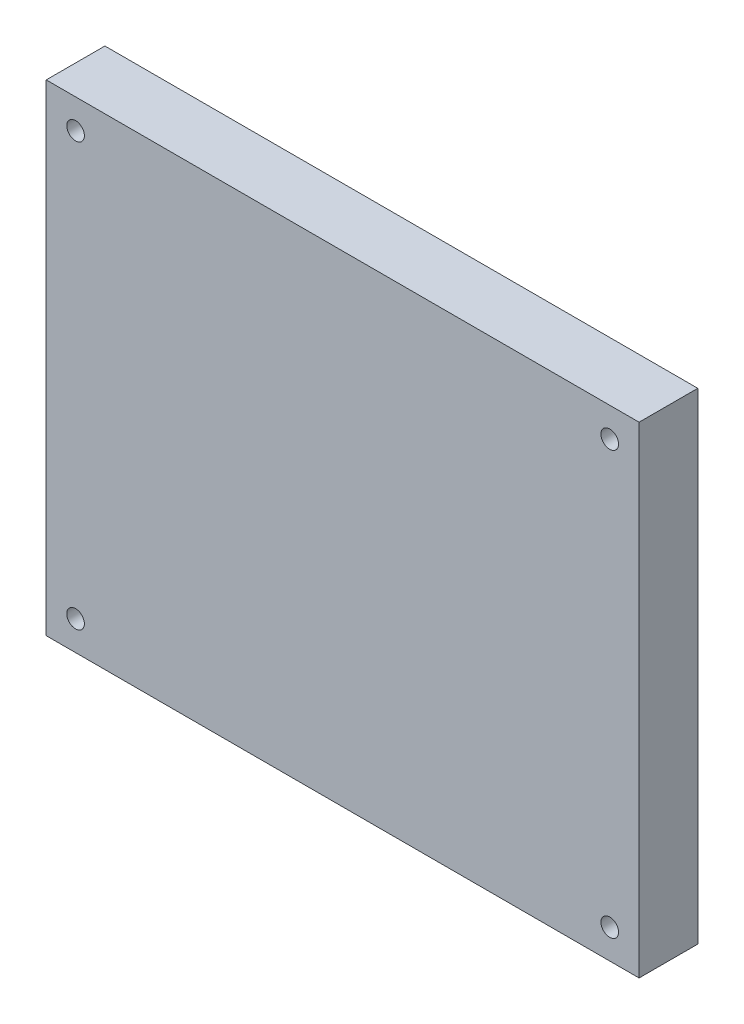
from build123d import *

# Parameters (mm, degrees)
ESQUISSE1_W      = 101
ESQUISSE1_H      = 82
EXTRUSION1_DEPTH = 10
ESQUISSE2_R      = 1.5
EXTRUSION2_DEPTH = 10


with BuildPart() as part:
    # Esquisse1 → Extrusion1 (new body)
    with BuildSketch(Plane.XY):
        with Locations((25.900742932, -26.035502646)):
            Rectangle(ESQUISSE1_W, ESQUISSE1_H)
    extrude(amount=EXTRUSION1_DEPTH)

    # Esquisse2 → Extrusion2 (cut)
    with BuildSketch(Plane.XY.offset(10)):
        with Locations((-19.599257068, 9.964497354)):
            Circle(ESQUISSE2_R)
        with Locations((71.400742932, 9.964497354)):
            Circle(ESQUISSE2_R)
        with Locations((71.400742932, -62.035502646)):
            Circle(ESQUISSE2_R)
        with Locations((-19.599257068, -62.035502646)):
            Circle(ESQUISSE2_R)
    extrude(amount=-EXTRUSION2_DEPTH, mode=Mode.SUBTRACT)


solid = part.part
